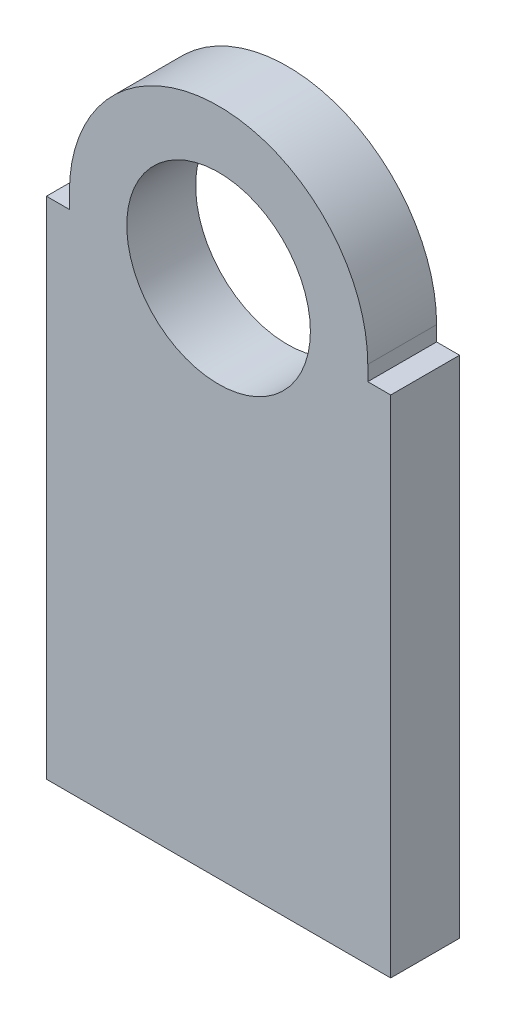
from build123d import *

# Parameters (mm, degrees)
SKETCH1_R           = 2
BOSS_EXTRUDE1_DEPTH = 1.5


with BuildPart() as part:
    # Sketch1 → Boss-Extrude1 (new body)
    with BuildSketch(Plane.XY):
        with BuildLine():
            Line((3.25, -0.326709371), (3.25, 0))
            ThreePointArc((3.25, 0), (0, 3.25), (-3.25, 0))
            Line((-3.25, 0), (-3.25, -0.326709371))
            Line((-3.25, -0.326709371), (-3.75, -0.326709371))
            Line((-3.75, -0.326709371), (-3.75, -11.326709371))
            Line((-3.75, -11.326709371), (3.75, -11.326709371))
            Line((3.75, -11.326709371), (3.75, -0.326709371))
            Line((3.75, -0.326709371), (3.25, -0.326709371))
        make_face()
        Circle(SKETCH1_R, mode=Mode.SUBTRACT)
    extrude(amount=BOSS_EXTRUDE1_DEPTH)


solid = part.part
